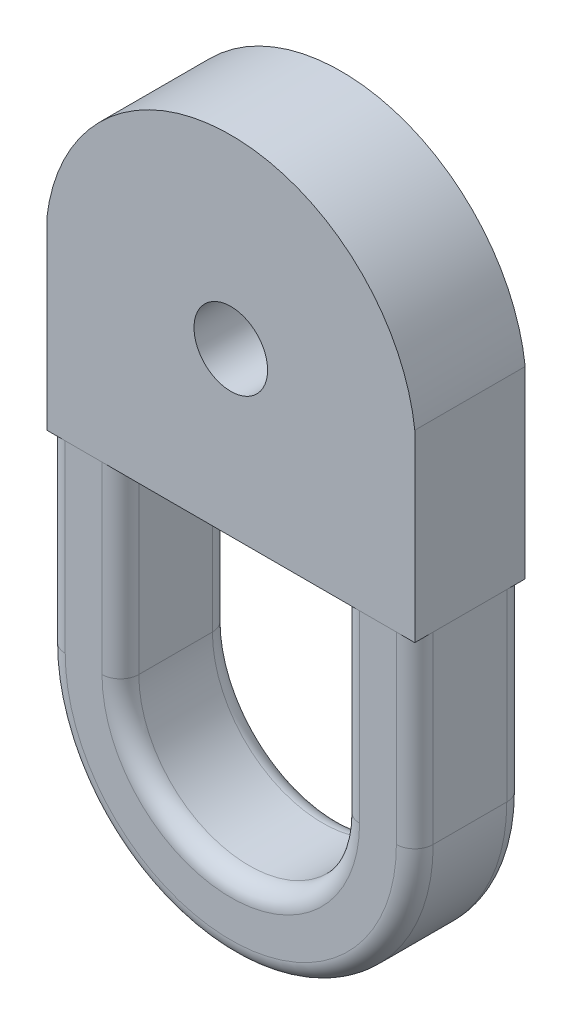
from build123d import *

# Parameters (mm, degrees)
SKETCH1_R           = 1
BOSS_EXTRUDE1_DEPTH = 3
BOSS_EXTRUDE2_DEPTH = 3
FILLET7_R           = 0.5


with BuildPart() as part:
    # Sketch1 → Boss-Extrude1 (new body)
    with BuildSketch(Plane.XY):
        with BuildLine():
            Line((0, 0), (0, 5))
            ThreePointArc((0, 5), (5, 9.447928245), (10, 5))
            Line((10, 5), (10, 0))
            Line((10, 0), (0, 0))
        make_face()
        with Locations((5, 4.413666988)):
            Circle(SKETCH1_R, mode=Mode.SUBTRACT)
    extrude(amount=BOSS_EXTRUDE1_DEPTH)


with BuildPart() as body_2:
    # Sketch2 → Boss-Extrude2 (new body)
    with BuildSketch(Plane.XY.offset(3)):
        with BuildLine():
            ThreePointArc((2, -1), (0.527864045, -2.763932023), (0, -5))
            ThreePointArc((0, -5), (5, -10), (10, -5))
            ThreePointArc((10, -5), (9.472135955, -2.763932023), (8, -1))
            Line((8, -1), (8, -5))
            ThreePointArc((8, -5), (5, -8), (2, -5))
            Line((2, -5), (2, -1))
        make_face()
        with BuildLine():
            Line((2, 0), (0, 0))
            Line((0, 0), (0, -5))
            ThreePointArc((0, -5), (0.527864045, -2.763932023), (2, -1))
            Line((2, -1), (2, 0))
        make_face()
        with BuildLine():
            ThreePointArc((8, -1), (9.472135955, -2.763932023), (10, -5))
            Line((10, -5), (10, 0))
            Line((10, 0), (8, 0))
            Line((8, 0), (8, -1))
        make_face()
    extrude(amount=-BOSS_EXTRUDE2_DEPTH)

    # Fillet7
    fillet7_edges = [body_2.edges().sort_by_distance(p)[0] for p in [
        (10, -2.5, 3),
        (5, -10, 3),
        (0, -2.5, 3),
        (2, -2.5, 3),
        (5, -8, 3),
        (0, -2.5, 0),
        (5, -10, 0),
        (10, -2.5, 0),
        (8, -2.5, 0),
        (5, -8, 0),
        (2, -2.5, 0),
        (8, -2.5, 3),
    ]]
    fillet(fillet7_edges, radius=FILLET7_R)


solid = Compound([part.part, body_2.part])
